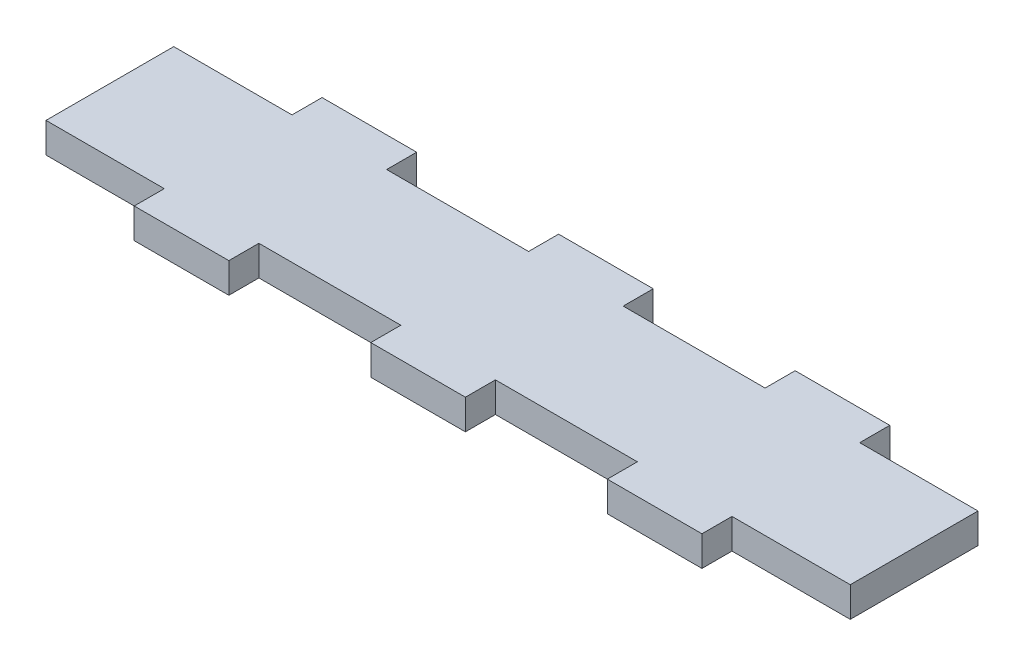
from build123d import *

# Parameters (mm, degrees)
BOSS_EXTRUDE1_DEPTH = 6.35


with BuildPart() as part:
    # Sketch1 → Boss-Extrude1 (new body)
    with BuildSketch(Plane(origin=(0, 0, 0), x_dir=(1, 0, 0), z_dir=(0, 1, 0))):
        Polygon((-85, 13.5), (-60, 13.5), (-60, 19.85), (-40, 19.85), (-40, 13.5), (-10, 13.5), (-10, 19.85), (10, 19.85), (10, 13.5), (40, 13.5), (40, 19.85), (60, 19.85), (60, 13.5), (85, 13.5), (85, -13.5), (60, -13.5), (60, -19.85), (40, -19.85), (40, -13.5), (10, -13.5), (10, -19.85), (-10, -19.85), (-10, -13.5), (-40, -13.5), (-40, -19.85), (-60, -19.85), (-60, -13.5), (-85, -13.5), align=None)
    extrude(amount=BOSS_EXTRUDE1_DEPTH)


solid = part.part
